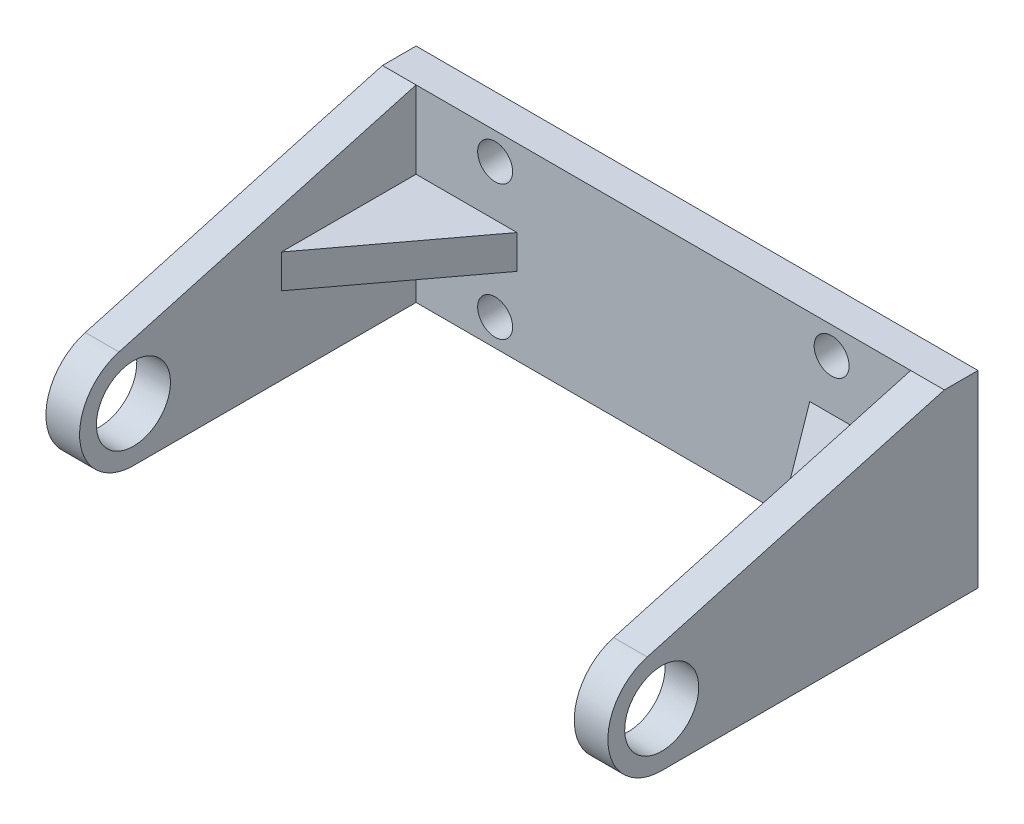
from build123d import *

# Parameters (mm, degrees)
SKETCH_1_W          = 83.5
SKETCH_1_H          = 28
EXTRUDE_1_DEPTH     = 5
SKETCH_2_R          = 5.5
EXTRUDE_2_DEPTH     = 5
EXTRUDE_START       = -5
SKETCH_3_R          = 5.5
EXTRUDE_3_DEPTH     = 5
SKETCH_4_R          = 2.6
CUT_EXTRUDE_2_DEPTH = 5
EXTRUDE_4_DEPTH     = 2.5


with BuildPart() as part:
    # 草图1 → 凸台-拉伸1 (new body)
    with BuildSketch(Plane.XY):
        Rectangle(SKETCH_1_W, SKETCH_1_H)
    extrude(amount=EXTRUDE_1_DEPTH)

    # 草图2 → 凸台-拉伸2 (add)
    with BuildSketch(Plane.ZY.offset(41.75)):
        with BuildLine():
            Line((5, 14), (5, -14))
            Line((5, -14), (47, -14))
            ThreePointArc((47, -14), (54.926353985, -7.083010852), (49.146081845, 1.706771874))
            Line((49.146081845, 1.706771874), (5, 14))
        make_face()
        with Locations(Location((47, -6, 0), (0, 0, 270))):
            Circle(SKETCH_2_R, mode=Mode.SUBTRACT)
    extrude(amount=-EXTRUDE_2_DEPTH)

    # 草图3 → 凸台-拉伸3 (add)
    with BuildSketch(Plane(origin=(41.75, 0, 0), x_dir=(0, 0, -1), z_dir=(1, 0, 0)).offset(EXTRUDE_START)):
        with BuildLine():
            Line((-5, 14), (-49.146081845, 1.706771874))
            ThreePointArc((-49.146081845, 1.706771874), (-54.926353985, -7.083010852), (-47, -14))
            Line((-47, -14), (-5, -14))
            Line((-5, -14), (-5, 14))
        make_face()
        with Locations(Location((-47, -6, 0), (0, 0, 270))):
            Circle(SKETCH_3_R, mode=Mode.SUBTRACT)
    extrude(amount=EXTRUDE_3_DEPTH)

    # 草图4 → 切除-拉伸2 (cut)
    with BuildSketch(Plane.XY.offset(5)):
        with Locations((-25, 10)):
            Circle(SKETCH_4_R)
        with Locations((25, 10)):
            Circle(SKETCH_4_R)
        with Locations((25, -10)):
            Circle(SKETCH_4_R)
        with Locations((-25, -10)):
            Circle(SKETCH_4_R)
    extrude(amount=-CUT_EXTRUDE_2_DEPTH, mode=Mode.SUBTRACT)

    # 草图5 → 凸台-拉伸4 (add, symmetric)
    with BuildSketch(Plane(origin=(0, 0, 0), x_dir=(1, 0, 0), z_dir=(0, 1, 0))):
        Polygon((-36.75, -5), (-21.75, -5), (-36.75, -25), align=None)
        Polygon((36.75, -5), (36.75, -25.085459481), (21.75, -5), align=None)
    extrude(amount=EXTRUDE_4_DEPTH, both=True)


solid = part.part
